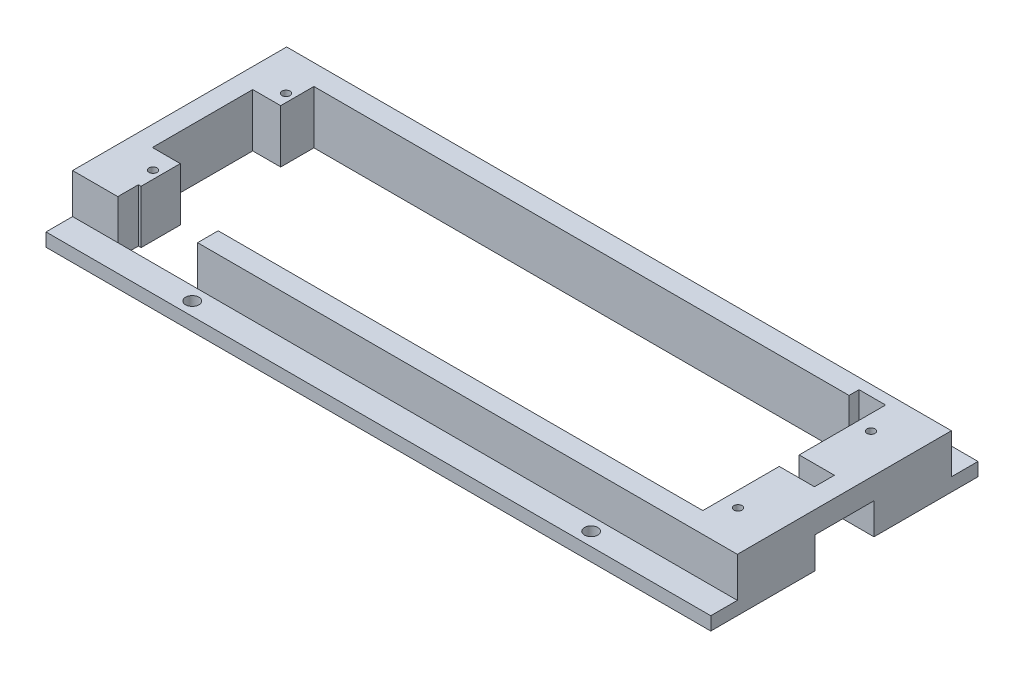
from build123d import *

# Parameters (mm, degrees)
SKETCH_1_W           = 94
SKETCH_1_H           = 26
SKETCH_1_R           = 0.6
EXTRUDE_1_DEPTH      = 8
SKETCH_2_W           = 4.7
SKETCH_2_H           = 8.9
SKETCH_2_W_2         = 59.6
SKETCH_2_H_2         = 6.6
CUT_EXTRUDE_1_DEPTH  = 50.416596402
SKETCH_3_R           = 1.5
CUT_EXTRUDE_2_DEPTH  = 50.416596402
SKETCH_5_W           = 7.8
SKETCH_5_H           = 2.6
SKETCH_5_W_2         = 8.6
SKETCH_5_H_2         = 2
CUT_EXTRUDE_4_DEPTH  = 6
SKETCH_5_3_W         = 15.6
SKETCH_5_3_H         = 2
CUT_EXTRUDE_5_DEPTH  = 20
SKETCH_6_W           = 70
SKETCH_6_H           = 19.6
SKETCH_6_W_2         = 18.8
SKETCH_6_H_2         = 3
SKETCH_6_W_3         = 82.8
SKETCH_6_H_3         = 11
SKETCH_6_W_4         = 3.2
SKETCH_6_H_4         = 5.2
CUT_EXTRUDE_12_DEPTH = 2
SKETCH_7_W           = 6.7
SKETCH_7_H           = 7.7
CUT_EXTRUDE_13_DEPTH = 0.5
SKETCH_8_W           = 7.4
SKETCH_8_H           = 5.4
SKETCH_8_W_2         = 15.6
SKETCH_8_H_2         = 1.5
EXTRUDE_2_DEPTH      = 2.1
SKETCH_10_W          = 19.8
SKETCH_10_H          = 1.9
SKETCH_10_W_2        = 11.8
SKETCH_10_H_2        = 4.2
EXTRUDE_3_DEPTH      = 2
EXTRUDE_4_REACH      = 53.894
SKETCH_12_W          = 100
SKETCH_12_H          = 32.2
SKETCH_12_W_2        = 94
SKETCH_12_H_2        = 26.1
SKETCH_12_3_W        = 4.3
SKETCH_12_3_H        = 3
SKETCH_12_3_W_2      = 1
SKETCH_12_3_W_3      = 3.2
SKETCH_12_3_H_2      = 5.2
CUT_EXTRUDE_16_DEPTH = 54.133887492
SKETCH_13_W          = 94
SKETCH_13_H          = 0.1
EXTRUDE_5_DEPTH      = 8
SKETCH_14_W          = 1
SKETCH_14_H          = 8
CUT_EXTRUDE_17_DEPTH = 0.5
SKETCH_15_W          = 100
SKETCH_15_H          = 4
EXTRUDE_6_DEPTH      = 2
SKETCH_16_W          = 12
SKETCH_16_H          = 3.1
CUT_EXTRUDE_18_DEPTH = 55.479445665
SKETCH_17_R          = 1
CUT_EXTRUDE_19_DEPTH = 55.221859061
CUT_EXTRUDE_20_REACH = 104.313
SKETCH_18_W          = 8.9
SKETCH_18_H          = 4.7
SKETCH_19_W          = 4
SKETCH_19_H          = 1.5
CUT_EXTRUDE_21_DEPTH = 55.479445665


with BuildPart() as part:
    # 草图1 → 凸台-拉伸1 (new body)
    with BuildSketch(Plane(origin=(0, 0, 0), x_dir=(1, 0, 0), z_dir=(0, 1, 0))):
        Rectangle(SKETCH_1_W, SKETCH_1_H)
        with Locations(Location((-44, 10, 0), (0, 0, 270))):
            Circle(SKETCH_1_R, mode=Mode.SUBTRACT)
        with Locations(Location((-44, -10, 0), (0, 0, 270))):
            Circle(SKETCH_1_R, mode=Mode.SUBTRACT)
        with Locations(Location((44, 10, 0), (0, 0, 270))):
            Circle(SKETCH_1_R, mode=Mode.SUBTRACT)
        with Locations(Location((44, -10, 0), (0, 0, 270))):
            Circle(SKETCH_1_R, mode=Mode.SUBTRACT)
    extrude(amount=EXTRUDE_1_DEPTH)

    # 草图2 → 切除-拉伸1 (cut, through all)
    with BuildSketch(Plane.XZ):
        with Locations((-44.65, 2.65)):
            Rectangle(SKETCH_2_W, SKETCH_2_H)
        with Locations((-4.8, 0)):
            Rectangle(SKETCH_2_W_2, SKETCH_2_H_2)
    extrude(amount=-CUT_EXTRUDE_1_DEPTH, mode=Mode.SUBTRACT)

    # 草图3 → 切除-拉伸2 (cut, through all)
    with BuildSketch(Plane(origin=(0, 0, 0), x_dir=(-1, 0, 0), z_dir=(0, -1, 0))):
        with Locations(Location((27.5, -10, 0), (0, 0, 90))):
            Circle(SKETCH_3_R)
    extrude(amount=-CUT_EXTRUDE_2_DEPTH, mode=Mode.SUBTRACT)

    # 草图5 → 切除-拉伸4 (cut)
    with BuildSketch(Plane.XY.offset(13)):
        with Locations((-37.2, 6.7)):
            Rectangle(SKETCH_5_W, SKETCH_5_H)
        with Locations((-27.5, 7)):
            Rectangle(SKETCH_5_W_2, SKETCH_5_H_2)
    extrude(amount=-CUT_EXTRUDE_4_DEPTH, mode=Mode.SUBTRACT)

    # 草图5<3> → 切除-拉伸5 (cut)
    with BuildSketch(Plane.XY.offset(13)):
        with Locations((32.9, 7)):
            Rectangle(SKETCH_5_3_W, SKETCH_5_3_H)
    extrude(amount=-CUT_EXTRUDE_5_DEPTH, mode=Mode.SUBTRACT)

    # 草图6 → 切除-拉伸12 (cut)
    with BuildSketch(Plane(origin=(0, 8, 0), x_dir=(1, 0, 0), z_dir=(0, 1, 0))):
        with Locations((-7.8, 2.7)):
            Rectangle(SKETCH_6_W, SKETCH_6_H)
        with Locations((36.6, 0)):
            Rectangle(SKETCH_6_W_2, SKETCH_6_H_2)
        with Locations((0.3, -7)):
            Rectangle(SKETCH_6_W_3, SKETCH_6_H_3)
        with Locations((-44.4, 5.4)):
            Rectangle(SKETCH_6_W_4, SKETCH_6_H_4)
    extrude(amount=-CUT_EXTRUDE_12_DEPTH, mode=Mode.SUBTRACT)

    # 草图7 → 切除-拉伸13 (cut)
    with BuildSketch(Plane(origin=(0, 6, 0), x_dir=(1, 0, 0), z_dir=(0, 1, 0))):
        with Locations((-27.35, 7.15)):
            Rectangle(SKETCH_7_W, SKETCH_7_H)
    extrude(amount=-CUT_EXTRUDE_13_DEPTH, mode=Mode.SUBTRACT)

    # 草图8 → 凸台-拉伸2 (add)
    with BuildSketch(Plane.XY.offset(13)):
        with Locations((-37.2, 2.7)):
            Rectangle(SKETCH_8_W, SKETCH_8_H)
        with Locations((32.9, 0.75)):
            Rectangle(SKETCH_8_W_2, SKETCH_8_H_2)
    extrude(amount=EXTRUDE_2_DEPTH)

    # 草图10 → 凸台-拉伸3 (add)
    with BuildSketch(Plane.ZY.offset(47)):
        with Locations((0, 0.95)):
            Rectangle(SKETCH_10_W, SKETCH_10_H)
        with Locations((0, 2.1)):
            Rectangle(SKETCH_10_W_2, SKETCH_10_H_2)
    extrude(amount=EXTRUDE_3_DEPTH)

    # 凸台-拉伸4: up to this face of the body (flat: up to its plane)
    extrude_4_end = Plane(part.part.faces().sort_by_distance((-45.999719539, 0, 11.45))[0])
    # 草图12 → 凸台-拉伸4 (add, up to the picked face)
    with BuildSketch(Plane(origin=(0, 8, 0), x_dir=(1, 0, 0), z_dir=(0, 1, 0)), mode=Mode.PRIVATE) as extrude_4_sk1:
        Rectangle(SKETCH_12_W, SKETCH_12_H)
        with Locations((0, -0.05)):
            Rectangle(SKETCH_12_W_2, SKETCH_12_H_2, mode=Mode.SUBTRACT)
    extrude_4_tool1 = split(extrude(extrude_4_sk1.sketch, amount=-EXTRUDE_4_REACH, mode=Mode.PRIVATE), bisect_by=extrude_4_end, keep=Keep.BOTH, mode=Mode.PRIVATE)
    add(extrude_4_tool1.solids().sort_by(Axis((48.949436, 8, 0), (0, -1, 0)))[0])

    # 草图12<3> → 切除-拉伸16 (cut, through all)
    with BuildSketch(Plane(origin=(0, 8, 0), x_dir=(1, 0, 0), z_dir=(0, 1, 0))):
        Polygon((41.7, 13), (-42.8, 13), (-42.8, 12.5), (27.2, 12.5), (27.2, 7), (40.7, 7), (40.7, 1.5), (41.7, 1.5), align=None)
        Polygon((27.2, 12.5), (-42.8, 12.5), (-42.8, 8), (-42.8, 2.8), (-42.8, 1.8), (-42.8, -13.1), (41.7, -13.1), (41.7, -13), (40.7, -13), (40.7, -12.5), (41.7, -12.5), (41.7, -1.5), (41.7, 1.5), (40.7, 1.5), (40.7, 7), (27.2, 7), align=None)
        with Locations((43.85, 0)):
            Rectangle(SKETCH_12_3_W, SKETCH_12_3_H)
        with Locations((46.5, 0)):
            Rectangle(SKETCH_12_3_W_2, SKETCH_12_3_H)
        with Locations((-44.4, 5.4)):
            Rectangle(SKETCH_12_3_W_3, SKETCH_12_3_H_2)
        with Locations((-46.5, 5.4)):
            Rectangle(SKETCH_12_3_W_2, SKETCH_12_3_H_2)
        Polygon((-46, 2.8), (-47, 2.8), (-47, 1.8), (-42.8, 1.8), (-42.8, 2.8), align=None)
    extrude(amount=-CUT_EXTRUDE_16_DEPTH, mode=Mode.SUBTRACT)

    # 草图13 → 凸台-拉伸5 (add)
    with BuildSketch(Plane(origin=(0, 8, 0), x_dir=(1, 0, 0), z_dir=(0, 1, 0))):
        with Locations((0, -13.05)):
            Rectangle(SKETCH_13_W, SKETCH_13_H)
    extrude(amount=-EXTRUDE_5_DEPTH)

    # 草图14 → 切除-拉伸17 (cut)
    with BuildSketch(Plane(origin=(0, 0, 13), x_dir=(-1, 0, 0), z_dir=(0, 0, -1))):
        with Locations((-41.2, 4)):
            Rectangle(SKETCH_14_W, SKETCH_14_H)
    extrude(amount=CUT_EXTRUDE_17_DEPTH, mode=Mode.SUBTRACT)

    # 草图15 → 凸台-拉伸6 (add)
    with BuildSketch(Plane.XZ):
        with Locations((0, 18.1)):
            Rectangle(SKETCH_15_W, SKETCH_15_H)
        with Locations((0, -18.1)):
            Rectangle(SKETCH_15_W, SKETCH_15_H)
    extrude(amount=-EXTRUDE_6_DEPTH)

    # 草图16 → 切除-拉伸18 (cut, through all)
    with BuildSketch(Plane(origin=(0, 8, 0), x_dir=(1, 0, 0), z_dir=(0, 1, 0))):
        with Locations((-37.2, -14.55)):
            Rectangle(SKETCH_16_W, SKETCH_16_H)
    extrude(amount=-CUT_EXTRUDE_18_DEPTH, mode=Mode.SUBTRACT)

    # 草图17 → 切除-拉伸19 (cut, through all)
    with BuildSketch(Plane(origin=(0, 2, 0), x_dir=(1, 0, 0), z_dir=(0, 1, 0))):
        with Locations(Location((30, 18.1, 0), (0, 0, 270))):
            Circle(SKETCH_17_R)
        with Locations(Location((30, -18.1, 0), (0, 0, 270))):
            Circle(SKETCH_17_R)
        with Locations(Location((-30, 18.1, 0), (0, 0, 270))):
            Circle(SKETCH_17_R)
        with Locations(Location((-30, -18.1, 0), (0, 0, 270))):
            Circle(SKETCH_17_R)
    extrude(amount=-CUT_EXTRUDE_19_DEPTH, mode=Mode.SUBTRACT)

    # 切除-拉伸20: up to this face of the body (flat: up to its plane)
    cut_extrude_20_end = Plane(part.part.faces().sort_by_distance((41.7, 4, 7.25))[0])
    # 草图18 → 切除-拉伸20 (cut, up to the picked face)
    with BuildSketch(Plane(origin=(50, 0, 0), x_dir=(0, 0, -1), z_dir=(1, 0, 0)), mode=Mode.PRIVATE) as cut_extrude_20_sk1:
        with Locations((0, 2.35)):
            Rectangle(SKETCH_18_W, SKETCH_18_H)
    cut_extrude_20_tool1 = split(extrude(cut_extrude_20_sk1.sketch, amount=-CUT_EXTRUDE_20_REACH, mode=Mode.PRIVATE), bisect_by=cut_extrude_20_end, keep=Keep.BOTH, mode=Mode.PRIVATE)
    add(cut_extrude_20_tool1.solids().sort_by(Axis((50, 2.35, 0), (-1, 0, 0)))[0], mode=Mode.SUBTRACT)

    # 草图19 → 切除-拉伸21 (cut, through all)
    with BuildSketch(Plane(origin=(0, 8, 0), x_dir=(1, 0, 0), z_dir=(0, 1, 0))):
        with Locations((39.7, 13.75)):
            Rectangle(SKETCH_19_W, SKETCH_19_H)
    extrude(amount=-CUT_EXTRUDE_21_DEPTH, mode=Mode.SUBTRACT)


solid = part.part
